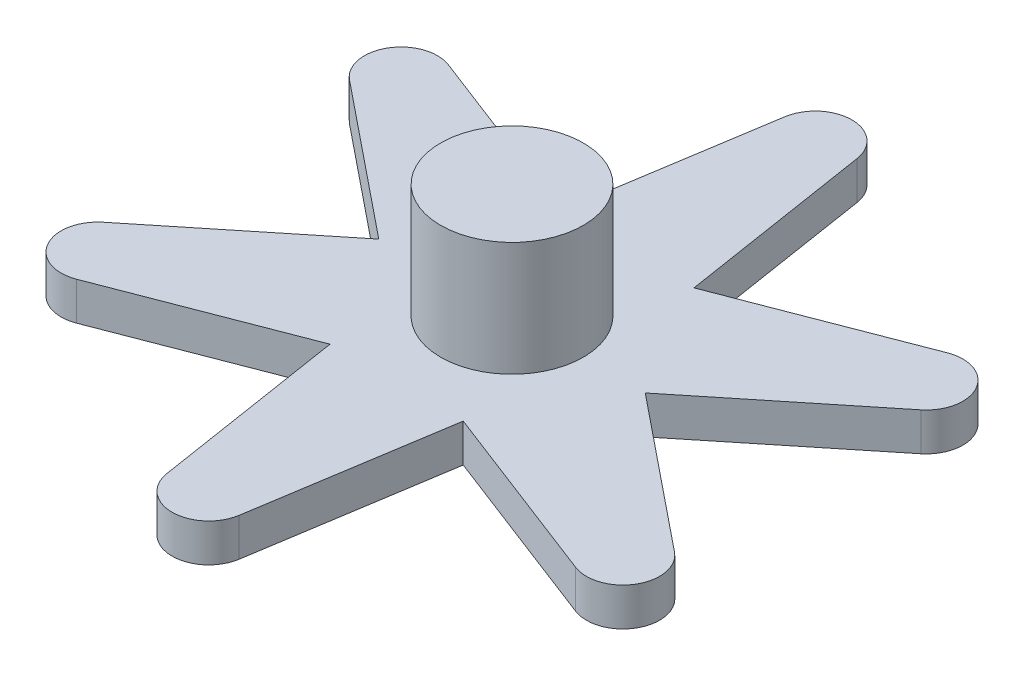
from build123d import *

# Parameters (mm, degrees)
SKETCH1_R           = 7
BOSS_EXTRUDE1_DEPTH = 2
BOSS_EXTRUDE2_START = -2
BOSS_EXTRUDE2_DEPTH = 2
CIRPATTERN1_COUNT   = 6
SKETCH3_R           = 3.75
BOSS_EXTRUDE3_DEPTH = 6


with BuildPart() as part:
    # Sketch1 → Boss-Extrude1 (new body)
    with BuildSketch(Plane(origin=(0, 0, 0), x_dir=(1, 0, 0), z_dir=(0, 1, 0))):
        with Locations(Location((0, 0, 0), (0, 0, 270))):
            Circle(SKETCH1_R)
    extrude(amount=BOSS_EXTRUDE1_DEPTH)

    # Sketch2 → Boss-Extrude2 (add)
    with BuildSketch(Plane(origin=(0, 2, 0), x_dir=(1, 0, 0), z_dir=(0, 1, 0)).offset(BOSS_EXTRUDE2_START)):
        with BuildLine():
            Line((-3.5, 6.062177826), (-1.9, 16.23236311))
            ThreePointArc((-1.9, 16.23236311), (0, 17.856819334), (1.9, 16.23236311))
            Line((1.9, 16.23236311), (3.5, 6.062177826))
            ThreePointArc((3.5, 6.062177826), (0, 7), (-3.5, 6.062177826))
        make_face()
    boss_extrude2 = extrude(amount=BOSS_EXTRUDE2_DEPTH)

    # CirPattern1: Boss-Extrude2 ×6 about axis
    cirpattern1_axis = Axis((0, 0, 0), (0, 1, 0))
    for i in range(1, CIRPATTERN1_COUNT):
        add(boss_extrude2.rotate(cirpattern1_axis, i * 360 / CIRPATTERN1_COUNT))

    # Sketch3 → Boss-Extrude3 (add)
    with BuildSketch(Plane(origin=(0, 2, 0), x_dir=(1, 0, 0), z_dir=(0, 1, 0))):
        with Locations(Location((0, 0, 0), (0, 0, 270))):
            Circle(SKETCH3_R)
    extrude(amount=BOSS_EXTRUDE3_DEPTH)


solid = part.part
